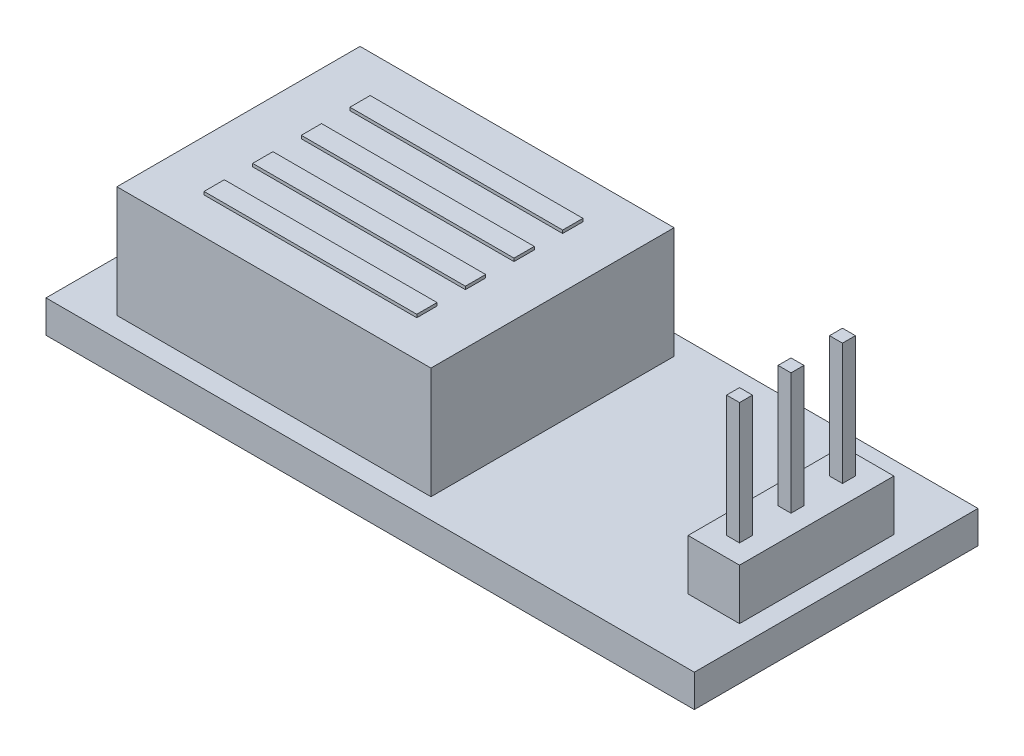
from build123d import *

# Parameters (mm, degrees)
SK_PCB_W            = 32
SK_PCB_H            = 14
PCB_DEPTH           = 1.6
DHT11_START         = 1.6
SK_DHT11_HOUSING_W  = 15.5
SK_DHT11_HOUSING_H  = 12
DHT11_HOUSING_DEPTH = 5.5
GRILLE_START        = 7.1
SK_GRILLE_W         = 10.5
SK_GRILLE_H         = 1
GRILLE_DEPTH        = 0.15
GRILLE_2_DEPTH      = 0.15
GRILLE_3_DEPTH      = 0.15
GRILLE_4_DEPTH      = 0.15
HEADER_START        = 1.6
SK_HEADER_3_PIN_W   = 2.54
SK_HEADER_3_PIN_H   = 7.62
HEADER_3_PIN_DEPTH  = 2.5
HEADER_START_2      = 4.1
SK_HEADER_PINS_W    = 0.64
SK_HEADER_PINS_H    = 0.64
HEADER_PINS_DEPTH   = 6
HEADER_PINS_2_DEPTH = 6
HEADER_PINS_3_DEPTH = 6


with BuildPart() as part:
    # SK PCB → PCB (new body)
    with BuildSketch(Plane(origin=(0, 0, 0), x_dir=(1, 0, 0), z_dir=(0, 1, 0))):
        with Locations((16, 7)):
            Rectangle(SK_PCB_W, SK_PCB_H)
    extrude(amount=PCB_DEPTH)


with BuildPart() as body_2:
    # SK DHT11 housing → DHT11 housing (new body)
    with BuildSketch(Plane(origin=(0, 0, 0), x_dir=(1, 0, 0), z_dir=(0, 1, 0)).offset(DHT11_START)):
        with Locations((10.25, 7)):
            Rectangle(SK_DHT11_HOUSING_W, SK_DHT11_HOUSING_H)
    extrude(amount=DHT11_HOUSING_DEPTH)


with BuildPart() as body_3:
    # SK Grille → Grille (new body)
    with BuildSketch(Plane(origin=(0, 0, 0), x_dir=(1, 0, 0), z_dir=(0, 1, 0)).offset(GRILLE_START)):
        with Locations((10.25, 10.5)):
            Rectangle(SK_GRILLE_W, SK_GRILLE_H)
    extrude(amount=GRILLE_DEPTH)


with BuildPart() as body_4:
    # SK Grille → Grille 2 (new body)
    with BuildSketch(Plane(origin=(0, 0, 0), x_dir=(1, 0, 0), z_dir=(0, 1, 0)).offset(GRILLE_START)):
        with Locations((10.25, 8.1)):
            Rectangle(SK_GRILLE_W, SK_GRILLE_H)
    extrude(amount=GRILLE_2_DEPTH)


with BuildPart() as body_5:
    # SK Grille → Grille 3 (new body)
    with BuildSketch(Plane(origin=(0, 0, 0), x_dir=(1, 0, 0), z_dir=(0, 1, 0)).offset(GRILLE_START)):
        with Locations((10.25, 5.7)):
            Rectangle(SK_GRILLE_W, SK_GRILLE_H)
    extrude(amount=GRILLE_3_DEPTH)


with BuildPart() as body_6:
    # SK Grille → Grille 4 (new body)
    with BuildSketch(Plane(origin=(0, 0, 0), x_dir=(1, 0, 0), z_dir=(0, 1, 0)).offset(GRILLE_START)):
        with Locations((10.25, 3.3)):
            Rectangle(SK_GRILLE_W, SK_GRILLE_H)
    extrude(amount=GRILLE_4_DEPTH)


with BuildPart() as body_7:
    # SK Header 3 pin → Header 3 pin (new body)
    with BuildSketch(Plane(origin=(0, 0, 0), x_dir=(1, 0, 0), z_dir=(0, 1, 0)).offset(HEADER_START)):
        with Locations((29.77, 7)):
            Rectangle(SK_HEADER_3_PIN_W, SK_HEADER_3_PIN_H)
    extrude(amount=HEADER_3_PIN_DEPTH)


with BuildPart() as body_8:
    # SK Header pins → Header pins (new body)
    with BuildSketch(Plane(origin=(0, 0, 0), x_dir=(1, 0, 0), z_dir=(0, 1, 0)).offset(HEADER_START_2)):
        with Locations((29.77, 9.54)):
            Rectangle(SK_HEADER_PINS_W, SK_HEADER_PINS_H)
    extrude(amount=HEADER_PINS_DEPTH)


with BuildPart() as body_9:
    # SK Header pins → Header pins 2 (new body)
    with BuildSketch(Plane(origin=(0, 0, 0), x_dir=(1, 0, 0), z_dir=(0, 1, 0)).offset(HEADER_START_2)):
        with Locations((29.77, 7)):
            Rectangle(SK_HEADER_PINS_W, SK_HEADER_PINS_H)
    extrude(amount=HEADER_PINS_2_DEPTH)


with BuildPart() as body_10:
    # SK Header pins → Header pins 3 (new body)
    with BuildSketch(Plane(origin=(0, 0, 0), x_dir=(1, 0, 0), z_dir=(0, 1, 0)).offset(HEADER_START_2)):
        with Locations((29.77, 4.46)):
            Rectangle(SK_HEADER_PINS_W, SK_HEADER_PINS_H)
    extrude(amount=HEADER_PINS_3_DEPTH)


solid = Compound([part.part, body_2.part, body_3.part, body_4.part, body_5.part, body_6.part, body_7.part, body_8.part, body_9.part, body_10.part])
